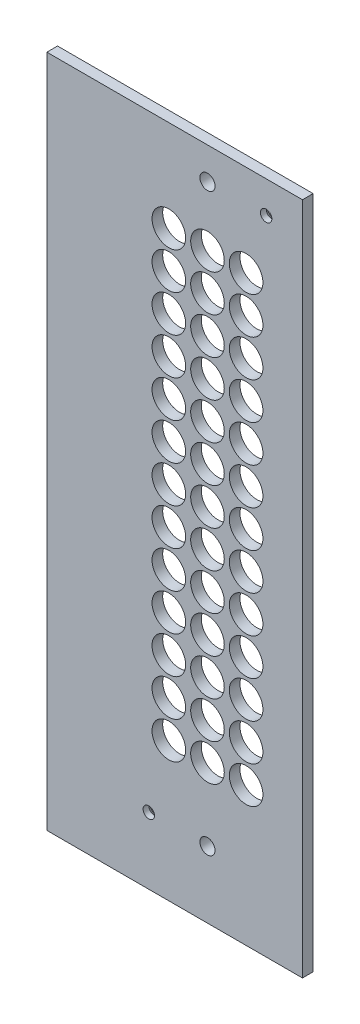
from build123d import *

# Parameters (mm, degrees)
SKETCH1_W                                       = 56.55
SKETCH1_H                                       = 197.425
BOSS_EXTRUDE1_DEPTH                             = 3.175
SKETCH4_R                                       = 5
CUT_EXTRUDE2_DEPTH                              = 103.731270343
LPATTERN3_COUNT                                 = 13
LPATTERN3_PITCH                                 = 11
SKETCH5_W                                       = 3.175
SKETCH5_H                                       = 197.425
BOSS_EXTRUDE2_DEPTH                             = 19.525
SKETCH14_W                                      = 76.075
SKETCH14_H                                      = 3.175
BOSS_EXTRUDE3_DEPTH                             = 3.175
M4_CLEARANCE_HOLE1_D                            = 4.5
CSK_FOR_M3_FLAT_HEAD_MACHINE_SCREW2_D           = 3.4
CSK_FOR_M3_FLAT_HEAD_MACHINE_SCREW2_CSINK_D     = 6.3
CSK_FOR_M3_FLAT_HEAD_MACHINE_SCREW2_CSINK_ANGLE = 90


with BuildPart() as part:
    # Sketch1 → Boss-Extrude1 (new body)
    with BuildSketch(Plane.XY):
        Rectangle(SKETCH1_W, SKETCH1_H)
    extrude(amount=BOSS_EXTRUDE1_DEPTH)

    # Sketch4 → Cut-Extrude2 (cut, through all)
    with BuildSketch(Plane.XY.offset(3.175)):
        with Locations((0, -57.369162839)):
            Circle(SKETCH4_R)
        with Locations((11.5, -57.369162839)):
            Circle(SKETCH4_R)
        with Locations((-11.5, -57.369162839)):
            Circle(SKETCH4_R)
    cut_extrude2 = extrude(amount=-CUT_EXTRUDE2_DEPTH, mode=Mode.SUBTRACT)

    # LPattern3: Cut-Extrude2 ×13
    with Locations(*[(0, i * LPATTERN3_PITCH, 0) for i in range(1, LPATTERN3_COUNT)]):
        add(cut_extrude2, mode=Mode.SUBTRACT)

    # Sketch5 → Boss-Extrude2 (add)
    with BuildSketch(Plane.ZY.offset(28.275)):
        with Locations((1.5875, 0)):
            Rectangle(SKETCH5_W, SKETCH5_H)
    extrude(amount=BOSS_EXTRUDE2_DEPTH)

    # Sketch14 → Boss-Extrude3 (add)
    with BuildSketch(Plane(origin=(0, 98.7125, 0), x_dir=(1, 0, 0), z_dir=(0, 1, 0))):
        with Locations((-9.7625, -1.5875)):
            Rectangle(SKETCH14_W, SKETCH14_H)
    extrude(amount=BOSS_EXTRUDE3_DEPTH)

    # M4 Clearance Hole1 (through all)
    with Locations(Plane.XY.offset(3.175)):
        with Locations((0, 92.3625001), (0, -78.8874999)):
            Hole(M4_CLEARANCE_HOLE1_D / 2)

    # CSK for M3 Flat Head Machine Screw2 (through all)
    with Locations(Plane(origin=(0, 0, 0), x_dir=(-1, 0, 0), z_dir=(0, 0, -1))):
        with Locations((17.4625, -78.8874999), (-17.4625, 92.3625001)):
            CounterSinkHole(CSK_FOR_M3_FLAT_HEAD_MACHINE_SCREW2_D / 2, CSK_FOR_M3_FLAT_HEAD_MACHINE_SCREW2_CSINK_D / 2, counter_sink_angle=CSK_FOR_M3_FLAT_HEAD_MACHINE_SCREW2_CSINK_ANGLE)


solid = part.part
